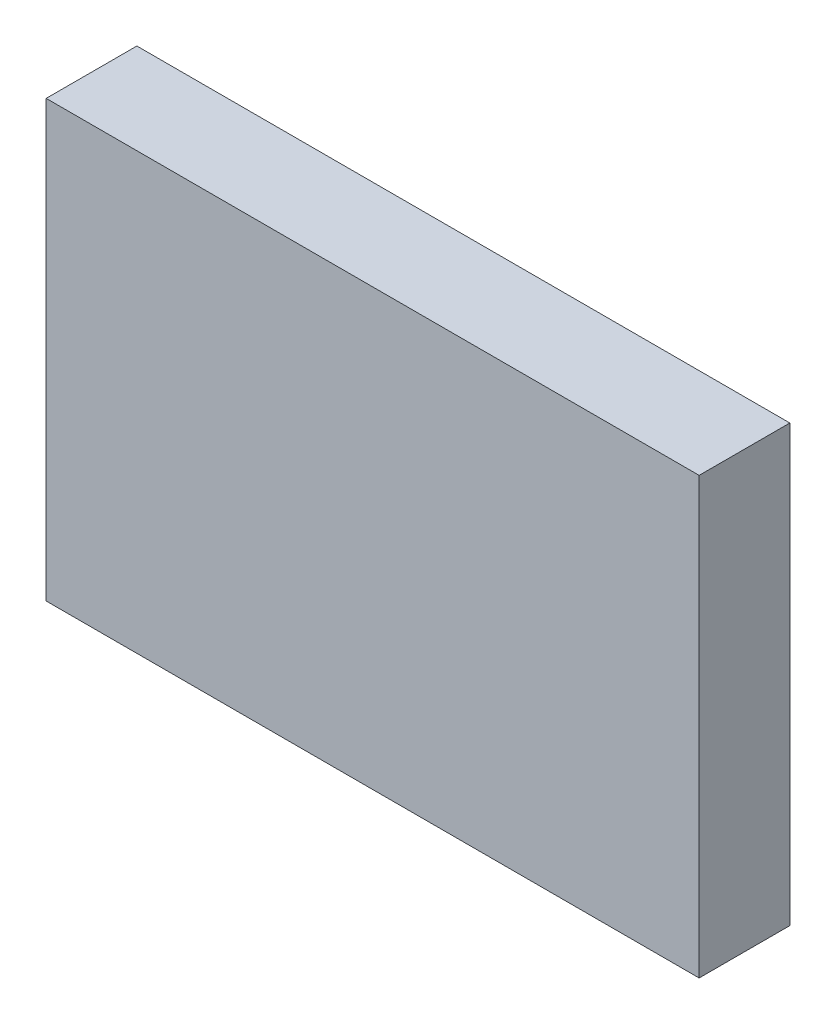
from build123d import *

# Parameters (mm, degrees)
SKIZZE1_W                       = 180
SKIZZE1_H                       = 120
AUFSATZ_LINEAR_AUSTRAGEN1_DEPTH = 25


with BuildPart() as part:
    # Skizze1 → Aufsatz-Linear austragen1 (new body)
    with BuildSketch(Plane.XY):
        Rectangle(SKIZZE1_W, SKIZZE1_H)
    extrude(amount=AUFSATZ_LINEAR_AUSTRAGEN1_DEPTH)


solid = part.part
